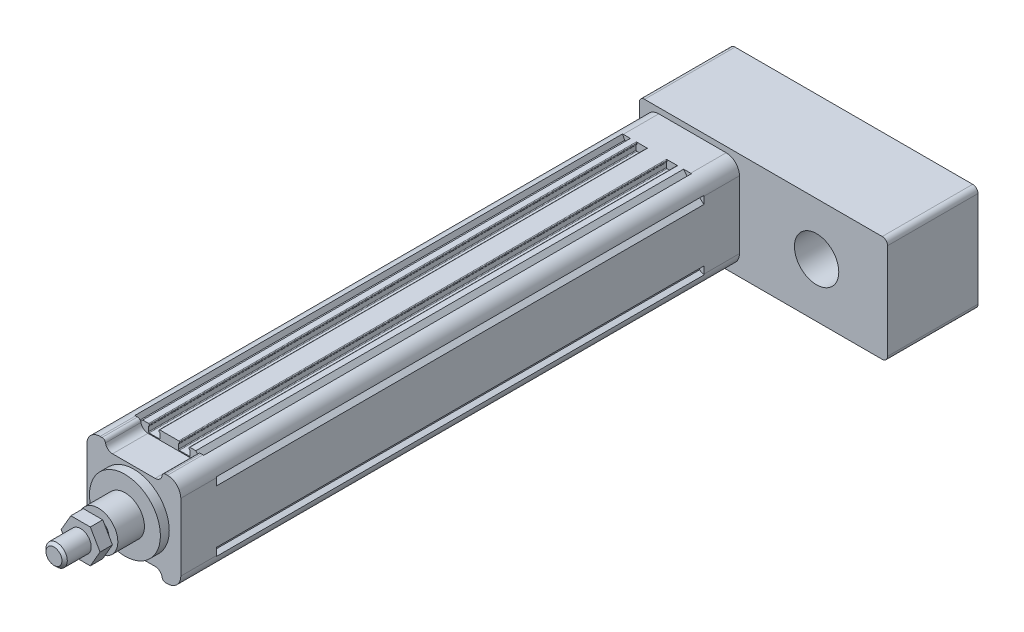
from build123d import *

# Parameters (mm, degrees)
SKETCH_1_R                  = 2.1
EXTRUDE_1_DEPTH             = 275
EXTRUDE_2_DEPTH             = 20
SKETCH_7_R                  = 20
EXTRUDE_3_DEPTH             = 5
SKETCH_9_R                  = 11
EXTRUDE_4_DEPTH             = 15
SKETCH_10_R                 = 6
EXTRUDE_5_DEPTH             = 25
EXTRUDE_START               = 20
EXTRUDE_6_DEPTH             = 20
EXTRUDE_7_DEPTH             = 51
SKETCH_13_R                 = 12.5
CUT_EXTRUDE_2_DEPTH         = 30
PATTERN_LINEAR_1_COUNT      = 2
PATTERN_LINEAR_1_PITCH      = 38
PATTERN_LINEAR_1_COUNT_DIR2 = 2
PATTERN_LINEAR_1_PITCH_DIR2 = 38
HOLE_WIZARD_M6_2_D          = 5
HOLE_WIZARD_M6_2_DEPTH      = 15
HOLE_WIZARD_M6_2_TIP        = 1.502151548
HOLE_WIZARD_M6_3_D          = 5
HOLE_WIZARD_M6_3_DEPTH      = 15
HOLE_WIZARD_M6_3_TIP        = 1.502151548
HOLE_WIZARD_M6_4_D          = 5
HOLE_WIZARD_M6_4_DEPTH      = 15
HOLE_WIZARD_M6_4_TIP        = 1.502151548
CHAMFER_1_SIZE              = 1.5
EXTRUDE_START_2             = 3
EXTRUDE_8_DEPTH             = 7


with BuildPart() as part:
    # 草图1 → 凸台-拉伸1 (new body)
    with BuildSketch(Plane.XY):
        with BuildLine():
            Line((-18.2, 24), (-19.443439638, 26.486879276))
            ThreePointArc((-19.443439638, 26.486879276), (-24.303300859, 24.303300859), (-26.486879276, 19.443439638))
            Line((-26.486879276, 19.443439638), (-24, 18.2))
            Line((-24, 18.2), (-24, 17.1))
            Line((-24, 17.1), (-26.5, 15))
            Line((-26.5, 15), (-26.5, -15))
            Line((-26.5, -15), (-24, -17.1))
            Line((-24, -17.1), (-24, -18.2))
            Line((-24, -18.2), (-26.486879276, -19.443439638))
            ThreePointArc((-26.486879276, -19.443439638), (-24.303300859, -24.303300859), (-19.443439638, -26.486879276))
            Line((-19.443439638, -26.486879276), (-18.2, -24))
            Line((-18.2, -24), (-17.1, -24))
            Line((-17.1, -24), (-15, -26.5))
            Line((-15, -26.5), (-11.65, -26.5))
            ThreePointArc((-11.65, -26.5), (-11.367157288, -26.382842712), (-11.25, -26.1))
            Line((-11.25, -26.1), (-11.25, -25.6))
            ThreePointArc((-11.25, -25.6), (-11.367157288, -25.317157288), (-11.65, -25.2))
            Line((-11.65, -25.2), (-11.75, -25.2))
            Line((-11.75, -25.2), (-11.75, -22.4))
            ThreePointArc((-11.75, -22.4), (-11.632842712, -22.117157288), (-11.35, -22))
            Line((-11.35, -22), (-5.65, -22))
            ThreePointArc((-5.65, -22), (-5.367157288, -22.117157288), (-5.25, -22.4))
            Line((-5.25, -22.4), (-5.25, -25.2))
            Line((-5.25, -25.2), (-5.35, -25.2))
            ThreePointArc((-5.35, -25.2), (-5.632842712, -25.317157288), (-5.75, -25.6))
            Line((-5.75, -25.6), (-5.75, -26.1))
            ThreePointArc((-5.75, -26.1), (-5.632842712, -26.382842712), (-5.35, -26.5))
            Line((-5.35, -26.5), (5.35, -26.5))
            ThreePointArc((5.35, -26.5), (5.632842712, -26.382842712), (5.75, -26.1))
            Line((5.75, -26.1), (5.75, -25.6))
            ThreePointArc((5.75, -25.6), (5.632842712, -25.317157288), (5.35, -25.2))
            Line((5.35, -25.2), (5.25, -25.2))
            Line((5.25, -25.2), (5.25, -22.4))
            ThreePointArc((5.25, -22.4), (5.367157288, -22.117157288), (5.65, -22))
            Line((5.65, -22), (11.35, -22))
            ThreePointArc((11.35, -22), (11.632842712, -22.117157288), (11.75, -22.4))
            Line((11.75, -22.4), (11.75, -25.2))
            Line((11.75, -25.2), (11.65, -25.2))
            ThreePointArc((11.65, -25.2), (11.367157288, -25.317157288), (11.25, -25.6))
            Line((11.25, -25.6), (11.25, -26.1))
            ThreePointArc((11.25, -26.1), (11.367157288, -26.382842712), (11.65, -26.5))
            Line((11.65, -26.5), (15, -26.5))
            Line((15, -26.5), (17.1, -24))
            Line((17.1, -24), (18.2, -24))
            Line((18.2, -24), (19.443439638, -26.486879276))
            ThreePointArc((19.443439638, -26.486879276), (24.303300859, -24.303300859), (26.486879276, -19.443439638))
            Line((26.486879276, -19.443439638), (24, -18.2))
            Line((24, -18.2), (24, -17.1))
            Line((24, -17.1), (26.5, -15))
            Line((26.5, -15), (26.5, 15))
            Line((26.5, 15), (24, 17.1))
            Line((24, 17.1), (24, 18.2))
            Line((24, 18.2), (26.486879276, 19.443439638))
            ThreePointArc((26.486879276, 19.443439638), (24.303300859, 24.303300859), (19.443439638, 26.486879276))
            Line((19.443439638, 26.486879276), (18.2, 24))
            Line((18.2, 24), (17.1, 24))
            Line((17.1, 24), (15, 26.5))
            Line((15, 26.5), (11.65, 26.5))
            ThreePointArc((11.65, 26.5), (11.367157288, 26.382842712), (11.25, 26.1))
            Line((11.25, 26.1), (11.25, 25.6))
            ThreePointArc((11.25, 25.6), (11.367157288, 25.317157288), (11.65, 25.2))
            Line((11.65, 25.2), (11.75, 25.2))
            Line((11.75, 25.2), (11.75, 22.4))
            ThreePointArc((11.75, 22.4), (11.632842712, 22.117157288), (11.35, 22))
            Line((11.35, 22), (5.65, 22))
            ThreePointArc((5.65, 22), (5.367157288, 22.117157288), (5.25, 22.4))
            Line((5.25, 22.4), (5.25, 25.2))
            Line((5.25, 25.2), (5.35, 25.2))
            ThreePointArc((5.35, 25.2), (5.632842712, 25.317157288), (5.75, 25.6))
            Line((5.75, 25.6), (5.75, 26.1))
            ThreePointArc((5.75, 26.1), (5.632842712, 26.382842712), (5.35, 26.5))
            Line((5.35, 26.5), (-5.35, 26.5))
            ThreePointArc((-5.35, 26.5), (-5.632842712, 26.382842712), (-5.75, 26.1))
            Line((-5.75, 26.1), (-5.75, 25.6))
            ThreePointArc((-5.75, 25.6), (-5.632842712, 25.317157288), (-5.35, 25.2))
            Line((-5.35, 25.2), (-5.25, 25.2))
            Line((-5.25, 25.2), (-5.25, 22.4))
            ThreePointArc((-5.25, 22.4), (-5.367157288, 22.117157288), (-5.65, 22))
            Line((-5.65, 22), (-11.35, 22))
            ThreePointArc((-11.35, 22), (-11.632842712, 22.117157288), (-11.75, 22.4))
            Line((-11.75, 22.4), (-11.75, 25.2))
            Line((-11.75, 25.2), (-11.65, 25.2))
            ThreePointArc((-11.65, 25.2), (-11.367157288, 25.317157288), (-11.25, 25.6))
            Line((-11.25, 25.6), (-11.25, 26.1))
            ThreePointArc((-11.25, 26.1), (-11.367157288, 26.382842712), (-11.65, 26.5))
            Line((-11.65, 26.5), (-15, 26.5))
            Line((-15, 26.5), (-17.1, 24))
            Line((-17.1, 24), (-18.2, 24))
        make_face()
        with Locations((19, 19)):
            Circle(SKETCH_1_R, mode=Mode.SUBTRACT)
        with Locations((19, -19)):
            Circle(SKETCH_1_R, mode=Mode.SUBTRACT)
        with Locations((-19, -19)):
            Circle(SKETCH_1_R, mode=Mode.SUBTRACT)
        with Locations((-19, 19)):
            Circle(SKETCH_1_R, mode=Mode.SUBTRACT)
        with BuildLine():
            Line((19.773719933, 3), (23.3, 3))
            Line((23.3, 3), (23.3, -3))
            Line((23.3, -3), (19.773719933, -3))
            ThreePointArc((19.773719933, -3), (0, -20), (-19.773719933, -3))
            Line((-19.773719933, -3), (-23.3, -3))
            Line((-23.3, -3), (-23.3, 3))
            Line((-23.3, 3), (-19.773719933, 3))
            ThreePointArc((-19.773719933, 3), (0, 20), (19.773719933, 3))
        make_face(mode=Mode.SUBTRACT)
    extrude(amount=EXTRUDE_1_DEPTH)

    # 草图6 → 凸台-拉伸2 (add)
    with BuildSketch(Plane.XY.offset(275)):
        with BuildLine():
            Line((-26.5, -19), (-26.5, 19))
            ThreePointArc((-26.5, 19), (-24.303300859, 24.303300859), (-19, 26.5))
            Line((-19, 26.5), (-17.916079783, 26.5))
            ThreePointArc((-17.916079783, 26.5), (-16.625085334, 26.027525232), (-15.944053189, 24.833333333))
            ThreePointArc((-15.944053189, 24.833333333), (-14.581988897, 22.444949537), (-12, 21.5))
            Line((-12, 21.5), (12, 21.5))
            ThreePointArc((12, 21.5), (14.581988897, 22.444949537), (15.944053189, 24.833333333))
            ThreePointArc((15.944053189, 24.833333333), (16.625085334, 26.027525232), (17.916079783, 26.5))
            Line((17.916079783, 26.5), (19, 26.5))
            ThreePointArc((19, 26.5), (24.303300859, 24.303300859), (26.5, 19))
            Line((26.5, 19), (26.5, -19))
            ThreePointArc((26.5, -19), (24.303300859, -24.303300859), (19, -26.5))
            Line((19, -26.5), (17.916079783, -26.5))
            ThreePointArc((17.916079783, -26.5), (16.625085334, -26.027525232), (15.944053189, -24.833333333))
            ThreePointArc((15.944053189, -24.833333333), (14.581988897, -22.444949537), (12, -21.5))
            Line((12, -21.5), (-12, -21.5))
            ThreePointArc((-12, -21.5), (-14.581988897, -22.444949537), (-15.944053189, -24.833333333))
            ThreePointArc((-15.944053189, -24.833333333), (-16.625085334, -26.027525232), (-17.916079783, -26.5))
            Line((-17.916079783, -26.5), (-19, -26.5))
            ThreePointArc((-19, -26.5), (-24.303300859, -24.303300859), (-26.5, -19))
        make_face()
    extrude(amount=EXTRUDE_2_DEPTH)

    # 草图7 → 凸台-拉伸3 (add)
    with BuildSketch(Plane.XY.offset(295)):
        Circle(SKETCH_7_R)
    extrude(amount=EXTRUDE_3_DEPTH)

    # 草图9 → 凸台-拉伸4 (add)
    with BuildSketch(Plane.XY.offset(300)):
        Circle(SKETCH_9_R)
    extrude(amount=EXTRUDE_4_DEPTH)

    # 草图10 → 凸台-拉伸5 (add)
    with BuildSketch(Plane.XY.offset(315)):
        Circle(SKETCH_10_R)
    extrude(amount=EXTRUDE_5_DEPTH)

    # 草图11 → 凸台-拉伸6 (add)
    with BuildSketch(Plane(origin=(0, 0, 0), x_dir=(-1, 0, 0), z_dir=(0, 0, -1)).offset(EXTRUDE_START)):
        with BuildLine():
            Line((-19, -26.5), (19, -26.5))
            ThreePointArc((19, -26.5), (24.303300859, -24.303300859), (26.5, -19))
            Line((26.5, -19), (26.5, 19))
            ThreePointArc((26.5, 19), (24.303300859, 24.303300859), (19, 26.5))
            Line((19, 26.5), (-19, 26.5))
            ThreePointArc((-19, 26.5), (-24.303300859, 24.303300859), (-26.5, 19))
            Line((-26.5, 19), (-26.5, -19))
            ThreePointArc((-26.5, -19), (-24.303300859, -24.303300859), (-19, -26.5))
        make_face()
    extrude(amount=-EXTRUDE_6_DEPTH)

    # 草图12 → 凸台-拉伸7 (add)
    with BuildSketch(Plane(origin=(0, 0, -20), x_dir=(-1, 0, 0), z_dir=(0, 0, -1))):
        with BuildLine():
            Line((-107, -30.404162038), (27, -30.404162038))
            ThreePointArc((27, -30.404162038), (29.121320344, -29.525482382), (30, -27.404162038))
            Line((30, -27.404162038), (30, 26.595837962))
            ThreePointArc((30, 26.595837962), (29.121320344, 28.717158305), (27, 29.595837962))
            Line((27, 29.595837962), (-107, 29.595837962))
            ThreePointArc((-107, 29.595837962), (-109.121320344, 28.717158305), (-110, 26.595837962))
            Line((-110, 26.595837962), (-110, -27.404162038))
            ThreePointArc((-110, -27.404162038), (-109.121320344, -29.525482382), (-107, -30.404162038))
        make_face()
    extrude(amount=EXTRUDE_7_DEPTH)

    # 草图13 → 切除-拉伸2 (cut)
    with BuildSketch(Plane.XY.offset(-20)):
        with Locations((70, 0)):
            Circle(SKETCH_13_R)
    extrude(amount=-CUT_EXTRUDE_2_DEPTH, mode=Mode.SUBTRACT)

    # 草图15 → M6 螺纹孔1 (revolve, cut)
    with BuildSketch(Plane(origin=(-19, -19, -71), x_dir=(0, 1, 0), z_dir=(1, 0, 0))):
        Polygon((0, 0), (0, 16.502151548), (2.5, 15), (2.5, 0), align=None)
    hole_wizard_m6_1 = revolve(axis=Axis((-19, -19, -77.35), (0, 0, 1)), mode=Mode.SUBTRACT)

    # 阵列(线性)1: Hole Wizard M6 _1 2 × 2
    with Locations(*[(j * PATTERN_LINEAR_1_PITCH_DIR2, i * PATTERN_LINEAR_1_PITCH, 0) for i in range(PATTERN_LINEAR_1_COUNT) for j in range(PATTERN_LINEAR_1_COUNT_DIR2) if (i, j) != (0, 0)]):
        add(hole_wizard_m6_1, mode=Mode.SUBTRACT)

    # M6 螺纹孔2
    with Locations(Plane(origin=(0, 0, -71), x_dir=(-1, 0, 0), z_dir=(0, 0, -1))):
        with Locations((-84, -19), (-84, 19)):
            Hole(HOLE_WIZARD_M6_2_D / 2, depth=HOLE_WIZARD_M6_2_DEPTH)
            with Locations((0, 0, -(HOLE_WIZARD_M6_2_DEPTH + HOLE_WIZARD_M6_2_TIP / 2))):  # 118° drill point
                Cone(0, HOLE_WIZARD_M6_2_D / 2, HOLE_WIZARD_M6_2_TIP, mode=Mode.SUBTRACT)

    # M6 螺纹孔3
    with Locations(Plane.ZY.offset(26.5)):
        with Locations((285, 11), (285, -11)):
            Hole(HOLE_WIZARD_M6_3_D / 2, depth=HOLE_WIZARD_M6_3_DEPTH)
            with Locations((0, 0, -(HOLE_WIZARD_M6_3_DEPTH + HOLE_WIZARD_M6_3_TIP / 2))):  # 118° drill point
                Cone(0, HOLE_WIZARD_M6_3_D / 2, HOLE_WIZARD_M6_3_TIP, mode=Mode.SUBTRACT)

    # M6 螺纹孔4
    with Locations(Plane.ZY.offset(26.5)):
        with Locations((-10, 11), (-10, -11)):
            Hole(HOLE_WIZARD_M6_4_D / 2, depth=HOLE_WIZARD_M6_4_DEPTH)
            with Locations((0, 0, -(HOLE_WIZARD_M6_4_DEPTH + HOLE_WIZARD_M6_4_TIP / 2))):  # 118° drill point
                Cone(0, HOLE_WIZARD_M6_4_D / 2, HOLE_WIZARD_M6_4_TIP, mode=Mode.SUBTRACT)

    # 倒角1
    chamfer_1_edges = [part.edges().sort_by_distance(p)[0] for p in [
        (-6, 0, 340),
    ]]
    chamfer(chamfer_1_edges, length=CHAMFER_1_SIZE)

    # 草图23 → 凸台-拉伸8 (add)
    with BuildSketch(Plane.XY.offset(315).offset(EXTRUDE_START_2)):
        Polygon((10.969655115, 0), (5.484827557, 9.5), (-5.484827557, 9.5), (-10.969655115, 0), (-5.484827557, -9.5), (5.484827557, -9.5), align=None)
    extrude(amount=EXTRUDE_8_DEPTH)


solid = part.part
